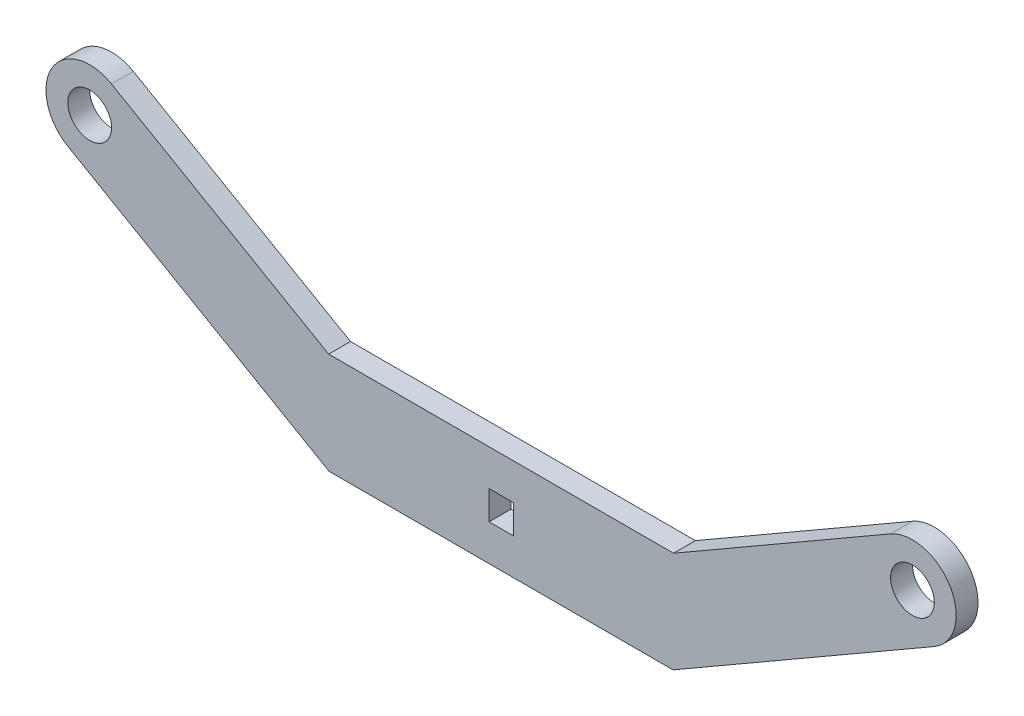
from build123d import *

# Parameters (mm, degrees)
SKETCH1_R           = 6.35
BOSS_EXTRUDE1_DEPTH = 6.35
CUT_EXTRUDE1_REACH  = 259.643
SKETCH2_W           = 7.108529786
SKETCH2_H           = 8.352611846


with BuildPart() as part:
    # Sketch1 → Boss-Extrude1 (new body)
    with BuildSketch(Plane.XY):
        with BuildLine():
            Line((6.35, 10.998522628), (69.394090512, -25.4))
            Line((69.394090512, -25.4), (169.571649488, -25.4))
            Line((169.571649488, -25.4), (232.61574, 10.998522628))
            ThreePointArc((232.61574, 10.998522628), (249.964262628, 6.35), (245.31574, -10.998522628))
            Line((245.31574, -10.998522628), (169.435593158, -54.807945834))
            Line((169.435593158, -54.807945834), (69.530146842, -54.807945834))
            Line((69.530146842, -54.807945834), (-6.35, -10.998522628))
            ThreePointArc((-6.35, -10.998522628), (-10.998522628, 6.35), (6.35, 10.998522628))
        make_face()
        Circle(SKETCH1_R, mode=Mode.SUBTRACT)
        with Locations((238.96574, 0)):
            Circle(SKETCH1_R, mode=Mode.SUBTRACT)
    extrude(amount=BOSS_EXTRUDE1_DEPTH)

    # Sketch2 → Cut-Extrude1 (cut, up to next)
    with BuildSketch(Plane.XY.offset(6.35), mode=Mode.PRIVATE) as cut_extrude1_sk1:
        with Locations((119.550898165, -40.103972917)):
            Rectangle(SKETCH2_W, SKETCH2_H)
    cut_extrude1_tool1 = extrude(cut_extrude1_sk1.sketch, amount=-CUT_EXTRUDE1_REACH, mode=Mode.PRIVATE) & part.part
    add(cut_extrude1_tool1.solids().sort_by_distance((119.550898, -40.103973, 6.35))[0], mode=Mode.SUBTRACT)


solid = part.part
